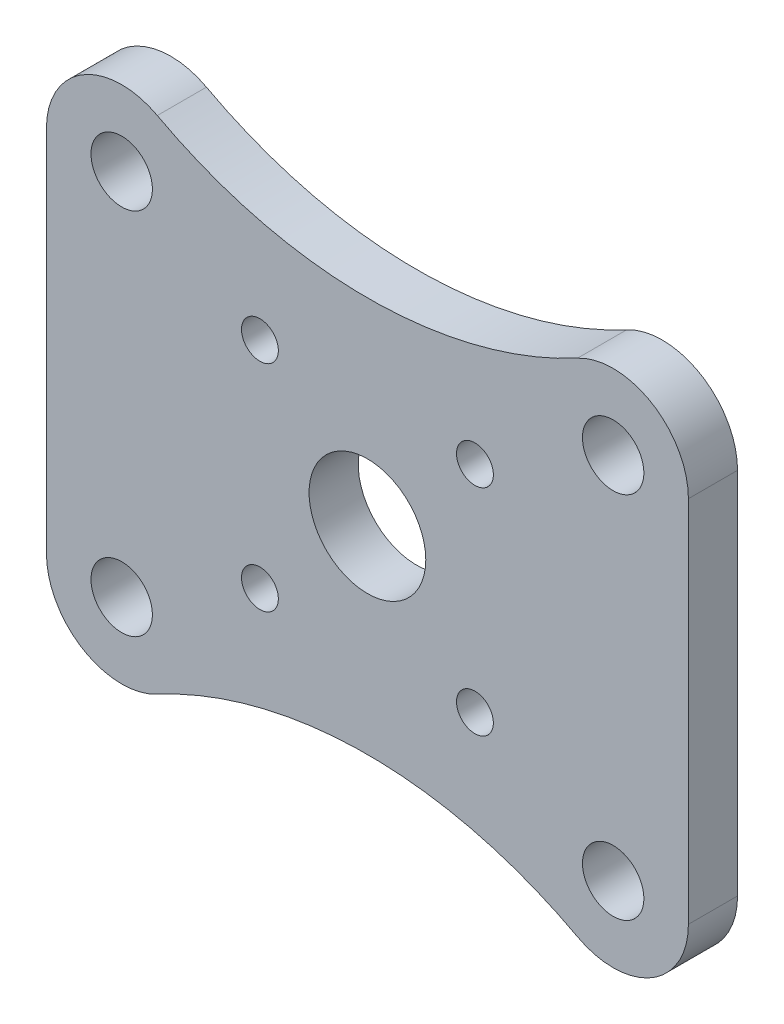
from build123d import *

# Parameters (mm, degrees)
SKETCH6_R           = 6.123610741
BOSS_EXTRUDE1_DEPTH = 4
SKETCH1_R           = 1.5
SKETCH1_R_2         = 4.75
CUT_EXTRUDE1_DEPTH  = 34.832676052
SKETCH4_R           = 2.5
CUT_EXTRUDE2_DEPTH  = 34.832676052


with BuildPart() as part:
    # Sketch6 → Boss-Extrude1 (new body)
    with BuildSketch(Plane.XY):
        with BuildLine():
            ThreePointArc((-13.876389259, 15), (-20, 8.876389259), (-26.123610741, 15))
            Line((-26.123610741, 15), (-26.123610741, -15))
            ThreePointArc((-26.123610741, -15), (-20, -8.876389259), (-13.876389259, -15))
            ThreePointArc((-13.876389259, -15), (-14.744302684, -18.142650827), (-17.102020228, -20.394471406))
            ThreePointArc((-17.102020228, -20.394471406), (0, -16.091558121), (17.102020228, -20.394471406))
            ThreePointArc((17.102020228, -20.394471406), (16.857349173, -9.744302684), (26.123610741, -15))
            Line((26.123610741, -15), (26.123610741, 15))
            ThreePointArc((26.123610741, 15), (16.857349173, 9.744302684), (17.102020228, 20.394471406))
            ThreePointArc((17.102020228, 20.394471406), (0, 16.091558121), (-17.102020228, 20.394471406))
            ThreePointArc((-17.102020228, 20.394471406), (-14.744302684, 18.142650827), (-13.876389259, 15))
        make_face()
        with Locations((-20, -15)):
            Circle(SKETCH6_R)
        with Locations((-20, 15)):
            Circle(SKETCH6_R)
        with Locations((20, 15)):
            Circle(SKETCH6_R)
        with Locations((20, -15)):
            Circle(SKETCH6_R)
    extrude(amount=BOSS_EXTRUDE1_DEPTH)

    # Sketch1 → Cut-Extrude1 (cut, through all)
    with BuildSketch(Plane.XY):
        with Locations((-8.75, -8.75)):
            Circle(SKETCH1_R)
        with Locations((-8.75, 8.75)):
            Circle(SKETCH1_R)
        with Locations((8.75, 8.75)):
            Circle(SKETCH1_R)
        with Locations((8.75, -8.75)):
            Circle(SKETCH1_R)
        Circle(SKETCH1_R_2)
    extrude(amount=CUT_EXTRUDE1_DEPTH, mode=Mode.SUBTRACT)

    # Sketch4 → Cut-Extrude2 (cut, through all)
    with BuildSketch(Plane.XY):
        with Locations((-20, 15)):
            Circle(SKETCH4_R)
        with Locations((20, 15)):
            Circle(SKETCH4_R)
        with Locations((20, -15)):
            Circle(SKETCH4_R)
        with Locations((-20, -15)):
            Circle(SKETCH4_R)
    extrude(amount=CUT_EXTRUDE2_DEPTH, mode=Mode.SUBTRACT)


solid = part.part
